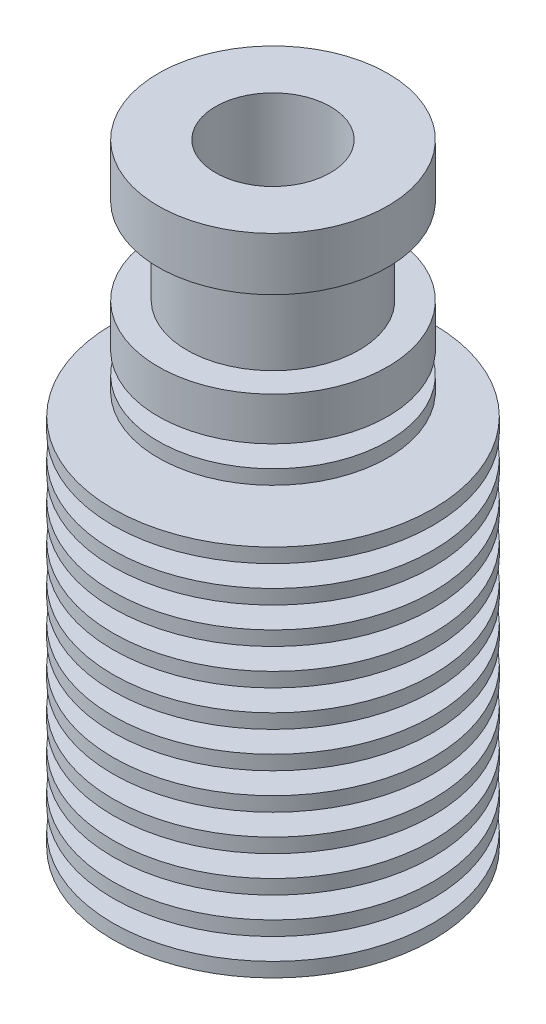
from build123d import *


with BuildPart() as part:
    # Sketch1 → Revolve1 (revolve)
    with BuildSketch(Plane.XY, mode=Mode.PRIVATE) as revolve1_sk:
        Polygon((11.15, 18.5), (5.082863863, 18.5), (5.082863863, 20), (11.15, 20), (11.15, 21), (4.951844414, 21), (4.951844414, 22.5), (11.15, 22.5), (11.15, 23.5), (4.820824966, 23.5), (4.820824966, 25), (11.15, 25), (11.15, 26), (4.689805518, 26), (4.689805518, 27.5), (8, 27.5), (8, 28.5), (4.689805518, 28.5), (4.689805518, 30), (8, 30), (8, 33), (6, 33), (6, 39), (8, 39), (8, 42.7), (4, 42.7), (4, 36.6), (2.1, 34.7), (2.1, 14.7), (3.5, 13.3), (3.5, 0), (11.15, 0), (11.15, 1), (6, 1), (6, 2.5), (11.15, 2.5), (11.15, 3.5), (5.868980552, 3.5), (5.868980552, 5), (11.15, 5), (11.15, 6), (5.737961104, 6), (5.737961104, 7.5), (11.15, 7.5), (11.15, 8.5), (5.606941655, 8.5), (5.606941655, 10), (11.15, 10), (11.15, 11), (5.475922207, 11), (5.475922207, 12.5), (11.15, 12.5), (11.15, 13.5), (5.344902759, 13.5), (5.344902759, 15), (11.15, 15), (11.15, 16), (5.213883311, 16), (5.213883311, 17.5), (11.15, 17.5), align=None)
    revolve(revolve1_sk.sketch.rotate(Axis((0, 42.7, 0), (0, -1, 0)), 270), axis=Axis((0, 42.7, 0), (0, -1, 0)))


solid = part.part
